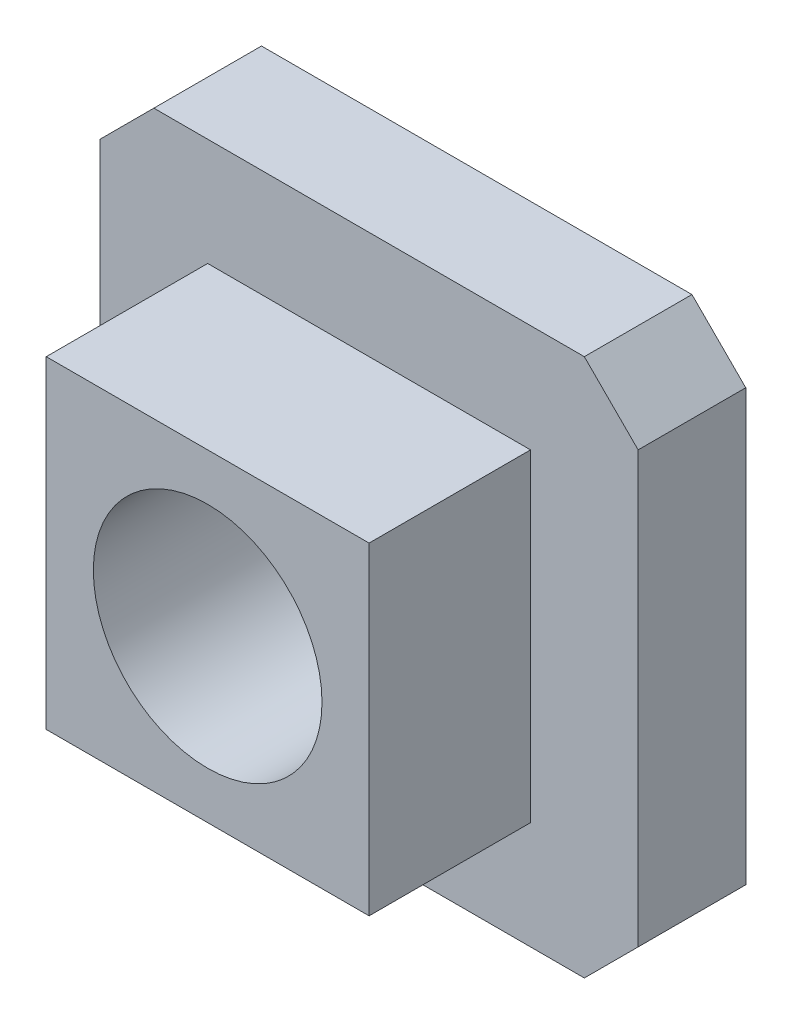
from build123d import *

# Parameters (mm, degrees)
SKETCH1_W               = 31.75
SKETCH1_H               = 31.75
BOSS_EXTRUDE1_DEPTH     = 3.175
SKETCH4_W               = 19.05
SKETCH4_H               = 19.05
BOSS_EXTRUDE2_DEPTH     = 9.525
F_5_8_11_TAPPED_HOLE2_D = 13.49248
CHAMFER1_SIZE           = 3.175


with BuildPart() as part:
    # Sketch1 → Boss-Extrude1 (new, symmetric)
    with BuildSketch(Plane.XY):
        Rectangle(SKETCH1_W, SKETCH1_H)
    extrude(amount=BOSS_EXTRUDE1_DEPTH, both=True)

    # Sketch4 → Boss-Extrude2 (add)
    with BuildSketch(Plane.XY.offset(3.175)):
        Rectangle(SKETCH4_W, SKETCH4_H)
    extrude(amount=BOSS_EXTRUDE2_DEPTH)

    # 5/8-11 Tapped Hole2 (through all)
    with Locations(Plane(origin=(0, 0, -3.175), x_dir=(-1, 0, 0), z_dir=(0, 0, -1))):
        with Locations((0, 0)):
            Hole(F_5_8_11_TAPPED_HOLE2_D / 2)

    # Chamfer1
    chamfer1_edges = [part.edges().sort_by_distance(p)[0] for p in [
        (-15.875, 15.875, 0),
        (15.875, 15.875, 0),
        (15.875, -15.875, 0),
        (-15.875, -15.875, 0),
    ]]
    chamfer(chamfer1_edges, length=CHAMFER1_SIZE)


solid = part.part
